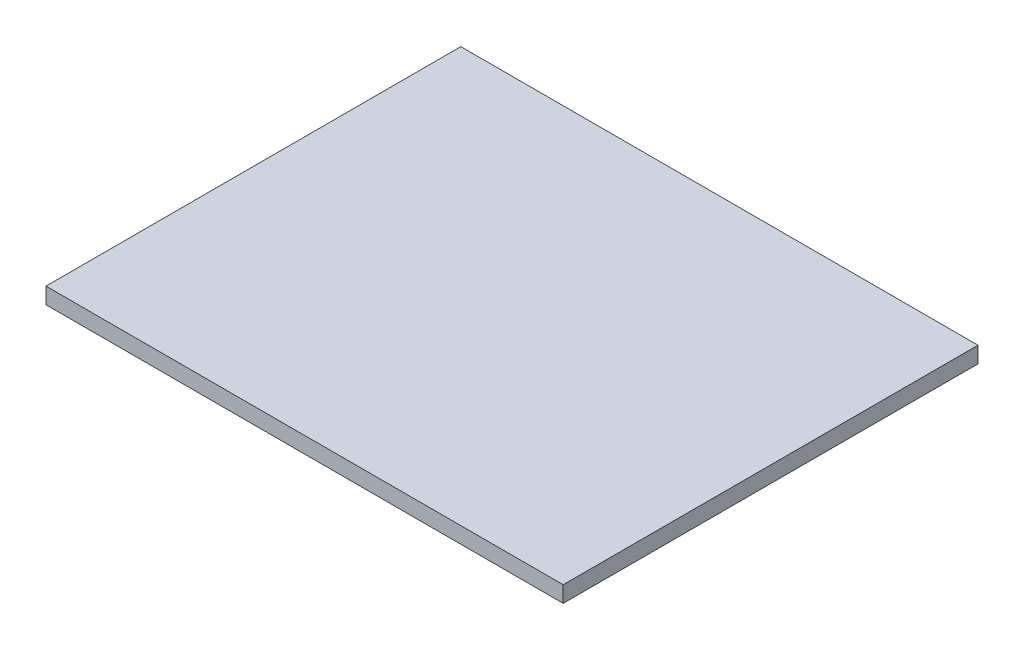
from build123d import *

# Parameters (mm, degrees)
SKETCH4_W           = 24.384
SKETCH4_H           = 19.558
BOSS_EXTRUDE1_DEPTH = 0.762
BOSS_EXTRUDE2_DEPTH = 0.762


with BuildPart() as part:
    # Sketch4 → Boss-Extrude1 (new body)
    with BuildSketch(Plane(origin=(0, 0, 0), x_dir=(1, 0, 0), z_dir=(0, 1, 0))):
        with Locations((11.43, 9.017)):
            Rectangle(SKETCH4_W, SKETCH4_H)
    extrude(amount=BOSS_EXTRUDE1_DEPTH)

    # Sketch6 → Boss-Extrude2 (add)
    with BuildSketch(Plane.XZ):
        Polygon((0, 0), (22.86, 0), (22.86, -18.034), (0, -18.034), (0, -12.192), (0.762, -12.192), (0.762, -17.272), (22.098, -17.272), (22.098, -0.762), (0.762, -0.762), (0.762, -5.842), (0, -5.842), align=None)
    extrude(amount=BOSS_EXTRUDE2_DEPTH)


solid = part.part
